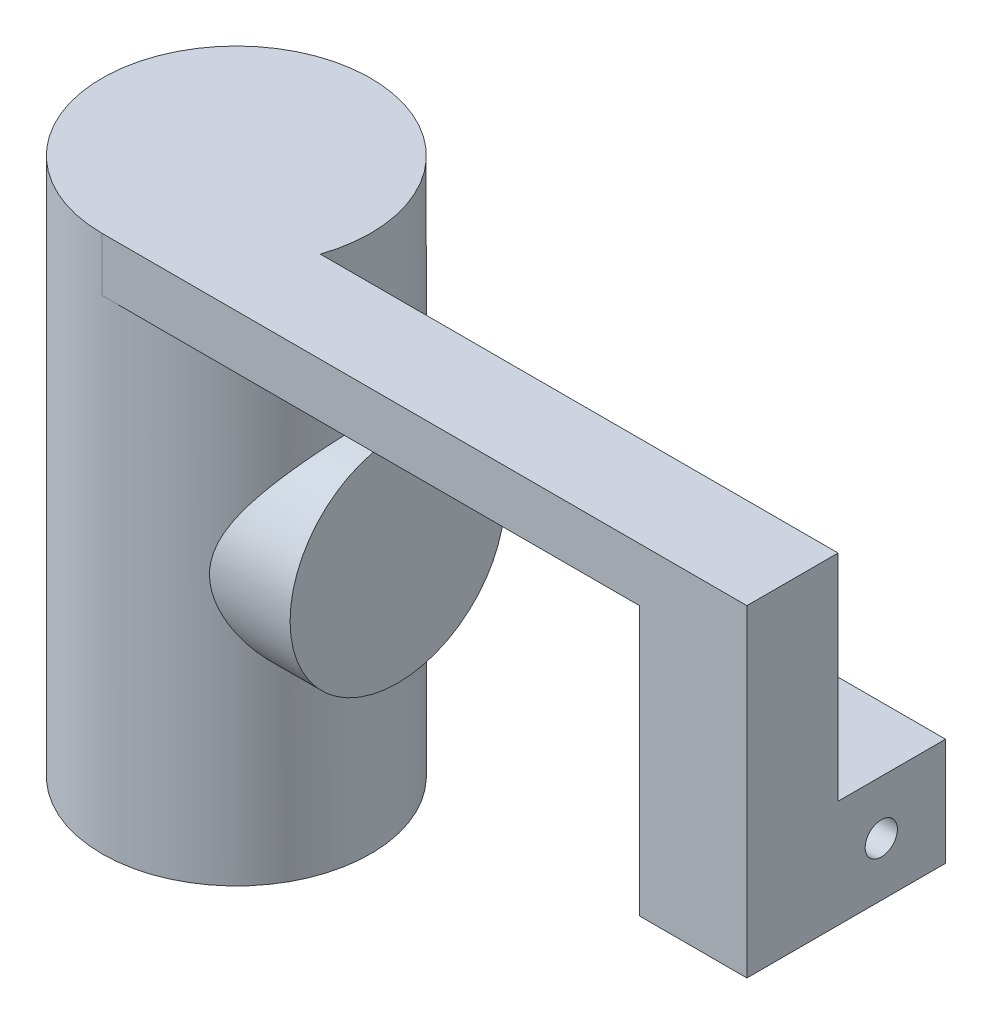
from build123d import *

# Parameters (mm, degrees)
SKETCH1_R           = 25
BOSS_EXTRUDE1_DEPTH = 50
SKETCH2_R           = 20
BOSS_EXTRUDE2_DEPTH = 30
SKETCH3_W           = 16.960857005
SKETCH3_H           = 10
BOSS_EXTRUDE3_DEPTH = 120
SKETCH4_W           = 20
SKETCH4_H           = 16.960857005
BOSS_EXTRUDE4_DEPTH = 50
SKETCH5_W           = 20
SKETCH5_H           = 20
BOSS_EXTRUDE5_DEPTH = 20
SKETCH6_R           = 3
CUT_EXTRUDE1_DEPTH  = 20


with BuildPart() as part:
    # Sketch1 → Boss-Extrude1 (new, symmetric)
    with BuildSketch(Plane(origin=(0, 0, 0), x_dir=(1, 0, 0), z_dir=(0, 1, 0))):
        with Locations(Location((0, 0, 0), (0, 0, 270))):
            Circle(SKETCH1_R)
    extrude(amount=BOSS_EXTRUDE1_DEPTH, both=True)

    # Sketch2 → Boss-Extrude2 (add)
    with BuildSketch(Plane(origin=(0, 0, 0), x_dir=(0, 0, -1), z_dir=(1, 0, 0))):
        with Locations(Location((0, 0, 0), (0, 0, 180))):
            Circle(SKETCH2_R)
    extrude(amount=BOSS_EXTRUDE2_DEPTH)

    # Sketch3 → Boss-Extrude3 (add)
    with BuildSketch(Plane(origin=(0, 0, 0), x_dir=(0, 0, -1), z_dir=(1, 0, 0))):
        with Locations((-16.519571497, 45)):
            Rectangle(SKETCH3_W, SKETCH3_H)
    extrude(amount=BOSS_EXTRUDE3_DEPTH)

    # Sketch4 → Boss-Extrude4 (add)
    with BuildSketch(Plane.XZ.offset(-40)):
        with Locations((110, 16.519571497)):
            Rectangle(SKETCH4_W, SKETCH4_H)
    extrude(amount=BOSS_EXTRUDE4_DEPTH)

    # Sketch5 → Boss-Extrude5 (add)
    with BuildSketch(Plane(origin=(0, 0, 8.039142995), x_dir=(-1, 0, 0), z_dir=(0, 0, -1))):
        with Locations((-110, 0)):
            Rectangle(SKETCH5_W, SKETCH5_H)
    extrude(amount=BOSS_EXTRUDE5_DEPTH)

    # Sketch6 → Cut-Extrude1 (cut)
    with BuildSketch(Plane(origin=(120, 0, 0), x_dir=(0, 0, -1), z_dir=(1, 0, 0))):
        Circle(SKETCH6_R)
    extrude(amount=-CUT_EXTRUDE1_DEPTH, mode=Mode.SUBTRACT)


solid = part.part
